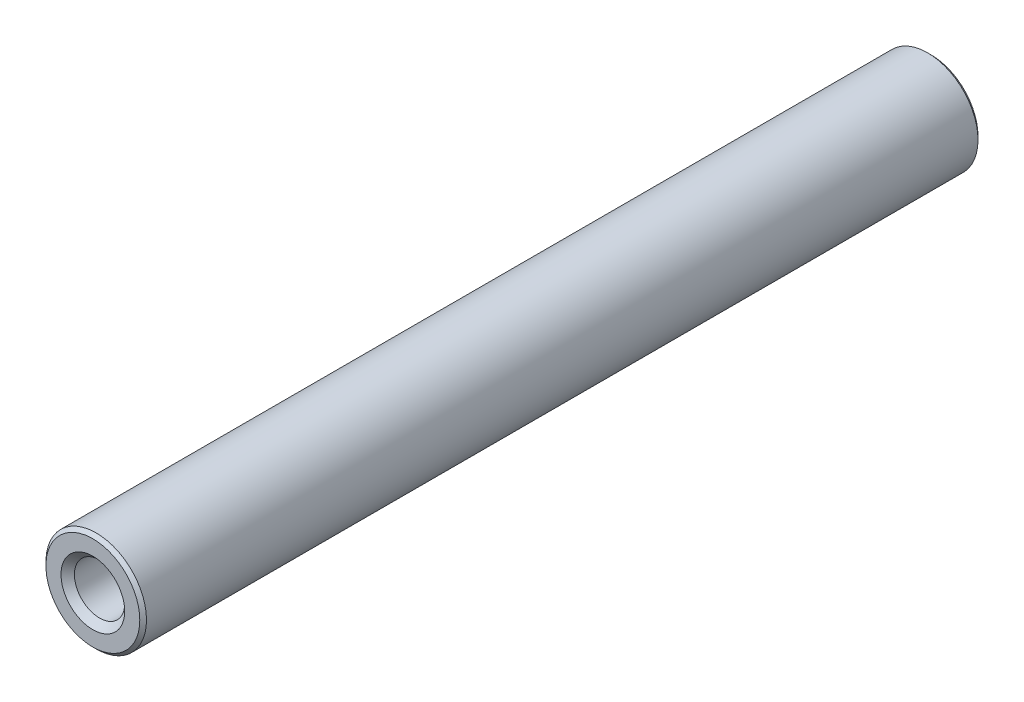
from build123d import *


with BuildPart() as part:
    # 草图1 → 旋转1 (revolve)
    with BuildSketch(Plane(origin=(0, 0, 0), x_dir=(1, 0, 0), z_dir=(0, 1, 0))):
        Polygon((1.5, 17), (0, 17), (0, -17), (1.5, -17), (1.5, -24.600059273), (1.899924924, -25), (2.79992954, -25), (3, -24.799924505), (3, 24.799958244), (2.799961089, 25), (1.899924924, 25), (1.5, 24.600059273), align=None)
    revolve(axis=Axis((0, 0, -25.003051641), (0, 0, 1)))


solid = part.part
